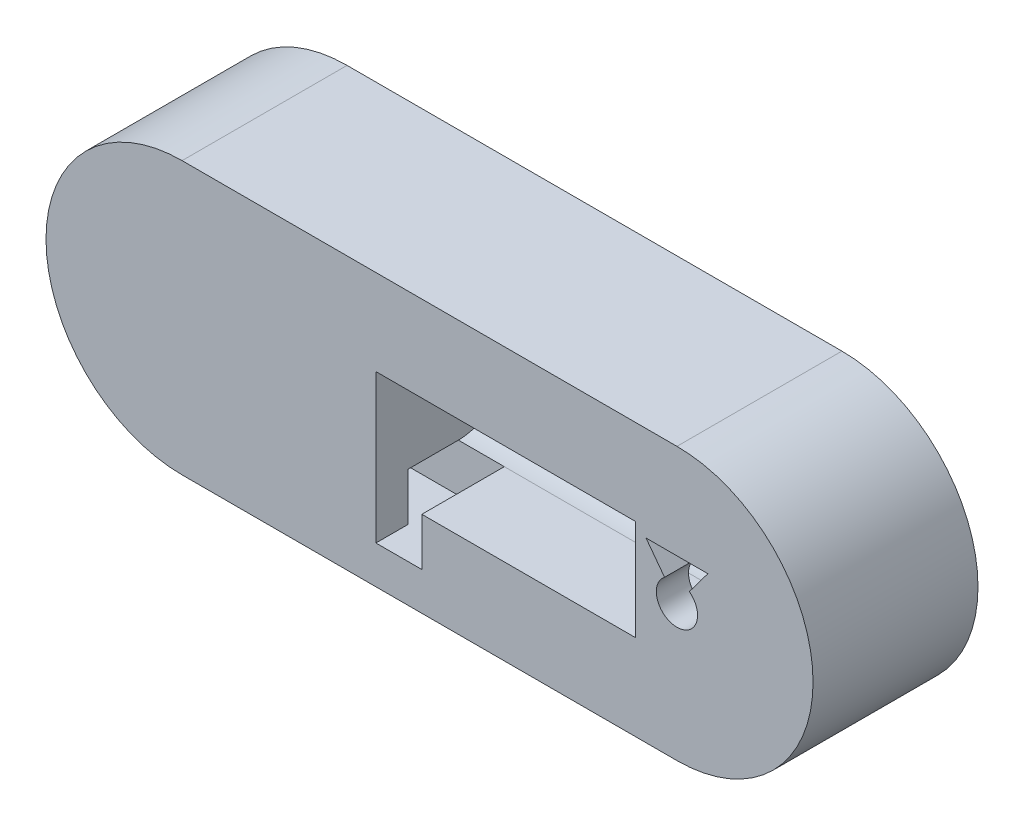
from build123d import *

# Parameters (mm, degrees)
SALIENTE_EXTRUIR1_DEPTH = 40
CORTAR_EXTRUIR2_DEPTH   = 10
CORTAR_EXTRUIR4_DEPTH   = 20
CROQUIS6_R              = 12.2
CORTAR_EXTRUIR6_DEPTH   = 63
CROQUIS7_W              = 24.4
CROQUIS7_H              = 24.4
CORTAR_EXTRUIR9_DEPTH   = 30
CROQUIS8_W              = 12.2
CROQUIS8_H              = 11.6
CORTAR_EXTRUIR10_DEPTH  = 50
CORTAR_EXTRUIR11_REACH  = 123.586
CROQUIS9_W              = 11.6
CROQUIS9_H              = 11.6
CHAFL_N1_SIZE           = 10


with BuildPart() as part:
    # Croquis1 → Saliente-Extruir1 (new body)
    with BuildSketch(Plane.XY):
        with BuildLine():
            Line((76.972889038, 33), (-43.027110962, 33))
            ThreePointArc((-43.027110962, 33), (-76.027110962, 0), (-43.027110962, -33))
            Line((-43.027110962, -33), (76.972889038, -33))
            ThreePointArc((76.972889038, -33), (109.972889038, 0), (76.972889038, 33))
        make_face()
        with BuildLine():
            Line((69.472889038, 10), (84.472889038, 10))
            Line((84.472889038, 10), (79.972889038, 4))
            ThreePointArc((79.972889038, 4), (76.972889038, -5), (73.972889038, 4))
            Line((73.972889038, 4), (69.472889038, 10))
        make_face(mode=Mode.SUBTRACT)
    extrude(amount=SALIENTE_EXTRUIR1_DEPTH)

    # Croquis1<4> → Cortar-Extruir2 (cut)
    with BuildSketch(Plane.XY):
        with BuildLine():
            Line((-39.234058455, -3.257722008), (-39.234058455, 3.257722008))
            ThreePointArc((-39.234058455, 3.257722008), (-48.027110962, 0), (-39.234058455, -3.257722008))
        make_face()
    extrude(amount=CORTAR_EXTRUIR2_DEPTH, mode=Mode.SUBTRACT)

    # Croquis5 → Cortar-Extruir4 (cut)
    with BuildSketch(Plane.XY.offset(40)):
        Polygon((66.972889038, -12.2), (66.972889038, 12.2), (3.972889038, 12.2), (3.972889038, -23.8), (15.110447518, -23.8), (15.110447518, -12.2), align=None)
    extrude(amount=-CORTAR_EXTRUIR4_DEPTH, mode=Mode.SUBTRACT)

    # Croquis6 → Cortar-Extruir6 (cut)
    with BuildSketch(Plane(origin=(3.972889038, 0, 0), x_dir=(0, 0, -1), z_dir=(1, 0, 0))):
        with Locations((-20, 0)):
            Circle(CROQUIS6_R)
        with BuildLine():
            ThreePointArc((-20, -12.2), (-32.2, 0), (-20, 12.2))
            Line((-20, 12.2), (-40, 12.2))
            Line((-40, 12.2), (-40, -12.2))
            Line((-40, -12.2), (-20, -12.2))
        make_face()
    extrude(amount=CORTAR_EXTRUIR6_DEPTH, mode=Mode.SUBTRACT)

    # Croquis7 → Cortar-Extruir9 (cut)
    with BuildSketch(Plane.ZY.offset(-66.972889038)):
        with Locations((20, 0)):
            Rectangle(CROQUIS7_W, CROQUIS7_H)
    extrude(amount=-CORTAR_EXTRUIR9_DEPTH, mode=Mode.SUBTRACT)

    # Croquis8 → Cortar-Extruir10 (cut)
    with BuildSketch(Plane(origin=(3.972889038, 0, 0), x_dir=(0, 0, -1), z_dir=(1, 0, 0))):
        with Locations((-26.1, -18)):
            Rectangle(CROQUIS8_W, CROQUIS8_H)
    extrude(amount=-CORTAR_EXTRUIR10_DEPTH, mode=Mode.SUBTRACT)

    # Croquis9 → Cortar-Extruir11 (cut, up to next)
    with BuildSketch(Plane(origin=(0, 0, 0), x_dir=(-1, 0, 0), z_dir=(0, 0, -1)), mode=Mode.PRIVATE) as cortar_extruir11_sk1:
        with Locations((40.227110962, -18)):
            Rectangle(CROQUIS9_W, CROQUIS9_H)
    cortar_extruir11_tool1 = extrude(cortar_extruir11_sk1.sketch, amount=-CORTAR_EXTRUIR11_REACH, mode=Mode.PRIVATE) & part.part
    add(cortar_extruir11_tool1.solids().sort_by_distance((-40.227111, -18, 0))[0], mode=Mode.SUBTRACT)

    # Chaflán1
    chafl_n1_edges = [part.edges().sort_by_distance(p)[0] for p in [
        (-46.027110962, -18, 0),
    ]]
    chamfer(chafl_n1_edges, length=CHAFL_N1_SIZE)


solid = part.part
